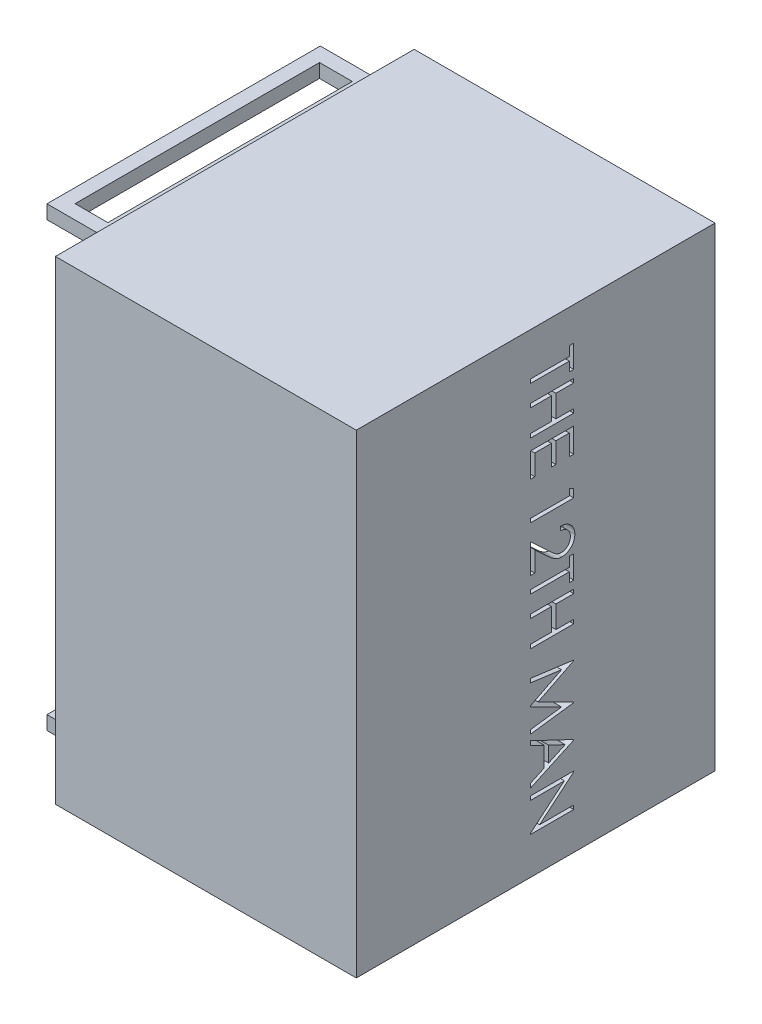
from build123d import *

# Parameters (mm, degrees)
SKETCH1_W           = 66.04
SKETCH1_H           = 104.14
BOSS_EXTRUDE1_DEPTH = 78.74
SHELL3_T            = -2.54
CUT_EXTRUDE7_DEPTH  = 40.64
CUT_EXTRUDE9_DEPTH  = 40.64
SKETCH8_W           = 59.988601374
SKETCH8_H           = 3.029727343
SKETCH8_H_2         = 3.029727342
BOSS_EXTRUDE3_DEPTH = 12.7
SKETCH9_W           = 7.202727341
SKETCH9_H           = 53.655099327
CUT_EXTRUDE10_DEPTH = 111.76


with BuildPart() as part:
    # Sketch1 → Boss-Extrude1 (new body)
    with BuildSketch(Plane.XY):
        with Locations((33.02, 52.07)):
            Rectangle(SKETCH1_W, SKETCH1_H)
    extrude(amount=BOSS_EXTRUDE1_DEPTH)

    # Shell3
    shell3_openings = [part.faces().sort_by_distance(p)[0] for p in [
        (33.02, 52.07, 0),
    ]]
    offset(amount=SHELL3_T, openings=shell3_openings, kind=Kind.INTERSECTION)

    # Sketch6 → Cut-Extrude7 (cut)
    # profile 1 of 10: a face of its own
    with BuildSketch(Plane(origin=(66.04, 0, 0), x_dir=(0, 0, -1), z_dir=(1, 0, 0))):
        Polygon((-31.996756627, 96.825288462), (-31.019833551, 96.825288462), (-31.019833551, 91.818557692), (-31.996756627, 91.818557692), (-31.996756627, 93.894519231), (-40.544833551, 93.894519231), (-40.544833551, 94.749326923), (-31.996756627, 94.749326923), align=None)
    # profile 2 of 10: a face of its own
    with BuildSketch(Plane(origin=(66.04, 0, 0), x_dir=(0, 0, -1), z_dir=(1, 0, 0))):
        Polygon((-31.019833551, 90.108942308), (-31.019833551, 89.254134615), (-34.927525858, 89.254134615), (-34.927525858, 84.369519231), (-31.019833551, 84.369519231), (-31.019833551, 83.514711538), (-40.544833551, 83.514711538), (-40.544833551, 84.369519231), (-35.904448935, 84.369519231), (-35.904448935, 89.254134615), (-40.544833551, 89.254134615), (-40.544833551, 90.108942308), align=None)
    # profile 3 of 10: a face of its own
    with BuildSketch(Plane(origin=(66.04, 0, 0), x_dir=(0, 0, -1), z_dir=(1, 0, 0))):
        Polygon((-31.019833551, 81.072403846), (-31.019833551, 75.699326923), (-31.996756627, 75.699326923), (-31.996756627, 80.217596154), (-34.927525858, 80.217596154), (-34.927525858, 75.699326923), (-35.904448935, 75.699326923), (-35.904448935, 80.217596154), (-39.567910474, 80.217596154), (-39.567910474, 75.699326923), (-40.544833551, 75.699326923), (-40.544833551, 81.072403846), align=None)
    # profile 4 of 10: a face of its own
    with BuildSketch(Plane(origin=(66.04, 0, 0), x_dir=(0, 0, -1), z_dir=(1, 0, 0))):
        Polygon((-31.019833551, 69.156613582), (-31.019833551, 67.395480769), (-40.544833551, 67.395480769), (-40.544833551, 68.250288462), (-31.996756627, 68.250288462), (-31.996756627, 69.715673077), align=None)
    # profile 5 of 10: a face of its own
    with BuildSketch(Plane(origin=(66.04, 0, 0), x_dir=(0, 0, -1), z_dir=(1, 0, 0))):
        with BuildLine():
            Line((-33.950602781, 62.632980769), (-33.950602781, 63.487788462))
            add(Edge.make_bspline(
                [(-33.950602781, 63.487788462), (-33.837197878, 63.482218229), (-33.614473665, 63.471278441), (-33.289750087, 63.420025178), (-32.979329471, 63.346756069), (-32.685873104, 63.242916648), (-32.405875402, 63.114684037), (-32.143054413, 62.957690211), (-31.894801667, 62.775282026), (-31.665817414, 62.567794117), (-31.456497177, 62.342650612), (-31.273825599, 62.101200471), (-31.121251832, 61.845925346), (-30.993010062, 61.579039383), (-30.896865922, 61.297455969), (-30.825497214, 61.003866724), (-30.782565304, 60.696944656), (-30.777950029, 60.48783026), (-30.775602781, 60.381478365)],
                knots=[0, 0, 0, 0, 1.100776268, 2.161895295, 3.184016182, 4.190939212, 5.176500551, 6.166955529, 7.155448256, 8.160289653, 9.16017456, 10.133824356, 11.091467644, 12.04088621, 13.000931625, 13.972173743, 14.968683325, 16, 16, 16, 16], degree=3))
            add(Edge.make_bspline(
                [(-30.775602781, 60.381478365), (-30.778047866, 60.277035178), (-30.782852371, 60.071808046), (-30.824112029, 59.772282135), (-30.888733961, 59.487138212), (-30.979399487, 59.216933648), (-31.101277107, 58.963824286), (-31.247683266, 58.725908715), (-31.417010093, 58.500354508), (-31.616365113, 58.297317476), (-31.829187317, 58.110877632), (-32.056393683, 57.950035066), (-32.291060525, 57.812294957), (-32.534977274, 57.697484199), (-32.790440572, 57.612967136), (-33.053731174, 57.548800727), (-33.32757441, 57.512531122), (-33.512921536, 57.506964648), (-33.607153262, 57.504134615)],
                knots=[0, 0, 0, 0, 1.111607364, 2.184268762, 3.212621178, 4.221274766, 5.211760367, 6.196651075, 7.1921475, 8.207485113, 9.220403448, 10.201281604, 11.166441695, 12.114753415, 13.065576456, 14.026450734, 14.996634279, 16, 16, 16, 16], degree=3))
            add(Edge.make_bspline(
                [(-33.607153262, 57.504134615), (-33.739817012, 57.508742709), (-34.002816451, 57.517878032), (-34.389299756, 57.596022156), (-34.763750418, 57.718068733), (-35.065114075, 57.865018683), (-35.307956655, 58.013261548), (-35.507896487, 58.146849694), (-35.723176369, 58.303236073), (-35.953075409, 58.484696842), (-36.199394372, 58.687478301), (-36.461984458, 58.913417189), (-36.738132632, 59.164124665), (-36.926742875, 59.340088156), (-37.024475978, 59.431268029)],
                knots=[0, 0, 0, 0, 1.184426356, 2.348067706, 3.509069118, 4.696110526, 5.333549288, 6.050745305, 6.844228056, 7.710549037, 8.667450064, 9.695053472, 10.805634456, 12, 12, 12, 12], degree=3))
            Line((-37.024475978, 59.431268029), (-39.567910474, 61.814426082))
            Line((-39.567910474, 61.814426082), (-39.567910474, 57.382019231))
            Line((-39.567910474, 57.382019231), (-40.544833551, 57.382019231))
            Line((-40.544833551, 57.382019231), (-40.544833551, 63.854134615))
            Line((-40.544833551, 63.854134615), (-36.602796291, 60.160144231))
            add(Edge.make_bspline(
                [(-36.602796291, 60.160144231), (-36.508916734, 60.0702004), (-36.32859332, 59.897436708), (-36.065246894, 59.653183612), (-35.821223644, 59.433452178), (-35.595442245, 59.238096647), (-35.389182666, 59.06695628), (-35.2008285, 58.920578652), (-35.031996146, 58.798316799), (-34.833658957, 58.668744712), (-34.591213606, 58.545189129), (-34.296423036, 58.436596414), (-33.992288171, 58.370855862), (-33.786825076, 58.362929391), (-33.683475377, 58.358942308)],
                knots=[0, 0, 0, 0, 1.329530082, 2.553755191, 3.672934919, 4.687409497, 5.60679272, 6.413407421, 7.126401618, 7.737995624, 8.834647426, 9.90044882, 10.943907757, 12, 12, 12, 12], degree=3))
            add(Edge.make_bspline(
                [(-33.683475377, 58.358942308), (-33.618476676, 58.360654663), (-33.490376716, 58.364029387), (-33.302685519, 58.394377114), (-33.120933467, 58.43896395), (-32.947367796, 58.507686036), (-32.778574803, 58.590253093), (-32.619686323, 58.695738596), (-32.465286227, 58.816280826), (-32.320668768, 58.9561039), (-32.188176719, 59.109603655), (-32.070820115, 59.271790415), (-31.972741593, 59.443375396), (-31.892341252, 59.623643525), (-31.829271059, 59.812090024), (-31.785568795, 60.009079965), (-31.758130032, 60.214068887), (-31.754417536, 60.354041473), (-31.752525858, 60.425363582)],
                knots=[0, 0, 0, 0, 0.991504627, 1.954065223, 2.895985987, 3.842598665, 4.797835564, 5.759220273, 6.74786863, 7.784730864, 8.824135544, 9.839918996, 10.835834653, 11.835434876, 12.84861661, 13.863796685, 14.911511676, 16, 16, 16, 16], degree=3))
            add(Edge.make_bspline(
                [(-31.752525858, 60.425363582), (-31.754471179, 60.499851679), (-31.758291468, 60.646134002), (-31.785031495, 60.860901823), (-31.831117999, 61.065803761), (-31.894301618, 61.261254599), (-31.973850295, 61.44744265), (-32.074843331, 61.622684403), (-32.193337583, 61.788579757), (-32.328414563, 61.944824021), (-32.479514174, 62.088387986), (-32.64587719, 62.217176527), (-32.828585783, 62.327019538), (-33.023513116, 62.424390424), (-33.235842064, 62.498893563), (-33.460427409, 62.562578129), (-33.700459972, 62.608840257), (-33.865836972, 62.624800282), (-33.950602781, 62.632980769)],
                knots=[0, 0, 0, 0, 1.031212865, 2.025131798, 2.990757446, 3.934781266, 4.865570067, 5.788494791, 6.729227313, 7.684356718, 8.643577152, 9.610526866, 10.590658432, 11.59095419, 12.621640561, 13.700587263, 14.82141059, 16, 16, 16, 16], degree=3))
        make_face()
    # profile 6 of 10: a face of its own
    with BuildSketch(Plane(origin=(66.04, 0, 0), x_dir=(0, 0, -1), z_dir=(1, 0, 0))):
        Polygon((-31.996756627, 56.771442308), (-31.019833551, 56.771442308), (-31.019833551, 51.764711538), (-31.996756627, 51.764711538), (-31.996756627, 53.840673077), (-40.544833551, 53.840673077), (-40.544833551, 54.695480769), (-31.996756627, 54.695480769), align=None)
    # profile 7 of 10: a face of its own
    with BuildSketch(Plane(origin=(66.04, 0, 0), x_dir=(0, 0, -1), z_dir=(1, 0, 0))):
        Polygon((-31.019833551, 50.055096154), (-31.019833551, 49.200288462), (-34.927525858, 49.200288462), (-34.927525858, 44.315673077), (-31.019833551, 44.315673077), (-31.019833551, 43.460865385), (-40.544833551, 43.460865385), (-40.544833551, 44.315673077), (-35.904448935, 44.315673077), (-35.904448935, 49.200288462), (-40.544833551, 49.200288462), (-40.544833551, 50.055096154), align=None)
    # profile 8 of 10: a face of its own
    with BuildSketch(Plane(origin=(66.04, 0, 0), x_dir=(0, 0, -1), z_dir=(1, 0, 0))):
        Polygon((-40.544833551, 37.843557692), (-31.019833551, 36.586150841), (-31.019833551, 36.464035457), (-38.835218166, 32.531538462), (-31.019833551, 28.608581731), (-31.019833551, 28.484558293), (-40.544833551, 27.219519231), (-40.544833551, 28.078143029), (-33.691107589, 28.990192308), (-40.544833551, 32.428503606), (-40.544833551, 32.621216947), (-33.675843166, 36.072884615), (-40.544833551, 36.983025841), align=None)
    # profile 9 of 10: a face of its own
    with BuildSketch(Plane(origin=(66.04, 0, 0), x_dir=(0, 0, -1), z_dir=(1, 0, 0))):
        Polygon((-31.019833551, 21.357980769), (-40.544833551, 16.961826923), (-40.544833551, 17.891048678), (-37.491948935, 19.299191707), (-37.491948935, 23.617115385), (-40.544833551, 25.065327524), (-40.544833551, 25.998365385), (-31.019833551, 21.480096154), align=None)
        Polygon((-32.876369007, 21.428578726), (-36.515025858, 23.153458534), (-36.515025858, 19.749492188), align=None, mode=Mode.SUBTRACT)
    # profile 10 of 10: a face of its own
    with BuildSketch(Plane(origin=(66.04, 0, 0), x_dir=(0, 0, -1), z_dir=(1, 0, 0))):
        Polygon((-40.544833551, 15.496442308), (-31.019833551, 15.496442308), (-31.019833551, 15.317085337), (-38.516573334, 9.024326923), (-31.019833551, 9.024326923), (-31.019833551, 8.169519231), (-40.544833551, 8.169519231), (-40.544833551, 8.364140625), (-33.065266243, 14.641634615), (-40.544833551, 14.641634615), align=None)
    extrude(amount=-CUT_EXTRUDE7_DEPTH, mode=Mode.SUBTRACT)


with BuildPart() as cut_extrude7_piece_1:
    # of the separate pieces the step leaves, piece 1, a body of its own (cut_extrude7_pieces)
    add(part.part.solids().sort_by_distance((0, 0, 0))[0])

    # Sketch7 → Cut-Extrude9 (cut)
    # profile 1 of 10: a face of its own
    with BuildSketch(Plane.ZY):
        Polygon((39.37, 88.399326923), (29.845, 88.399326923), (29.845, 88.578683894), (37.341739784, 94.871442308), (29.845, 94.871442308), (29.845, 95.72625), (39.37, 95.72625), (39.37, 95.531628606), (31.890432692, 89.254134615), (39.37, 89.254134615), align=None)
    # profile 2 of 10: a face of its own
    with BuildSketch(Plane.ZY):
        Polygon((29.845, 82.537788462), (39.37, 86.933942308), (39.37, 86.004720553), (36.317115385, 84.596577524), (36.317115385, 80.278653846), (39.37, 78.830441707), (39.37, 77.897403846), (29.845, 82.415673077), align=None)
        Polygon((31.701535457, 82.467190505), (35.340192308, 80.742310697), (35.340192308, 84.146277043), align=None, mode=Mode.SUBTRACT)
    # profile 3 of 10: a face of its own
    with BuildSketch(Plane.ZY):
        Polygon((39.37, 66.052211538), (29.845, 67.309618389), (29.845, 67.431733774), (37.660384615, 71.364230769), (29.845, 75.2871875), (29.845, 75.411210937), (39.37, 76.67625), (39.37, 75.817626202), (32.516274038, 74.905576923), (39.37, 71.467265625), (39.37, 71.274552284), (32.501009615, 67.822884615), (39.37, 66.912743389), align=None)
    # profile 4 of 10: a face of its own
    with BuildSketch(Plane.ZY):
        Polygon((29.845, 53.840673077), (29.845, 54.695480769), (33.752692308, 54.695480769), (33.752692308, 59.580096154), (29.845, 59.580096154), (29.845, 60.434903846), (39.37, 60.434903846), (39.37, 59.580096154), (34.729615385, 59.580096154), (34.729615385, 54.695480769), (39.37, 54.695480769), (39.37, 53.840673077), align=None)
    # profile 5 of 10: a face of its own
    with BuildSketch(Plane.ZY):
        Polygon((30.821923077, 47.124326923), (29.845, 47.124326923), (29.845, 52.131057692), (30.821923077, 52.131057692), (30.821923077, 50.055096154), (39.37, 50.055096154), (39.37, 49.200288462), (30.821923077, 49.200288462), align=None)
    # profile 6 of 10: a face of its own
    with BuildSketch(Plane.ZY):
        with BuildLine():
            Line((32.775769231, 41.262788462), (32.775769231, 40.407980769))
            add(Edge.make_bspline(
                [(32.775769231, 40.407980769), (32.662364886, 40.41355195), (32.439641772, 40.424493601), (32.114910283, 40.475733445), (31.804518295, 40.549051118), (31.51095803, 40.652714289), (31.231633847, 40.781454945), (30.967655233, 40.935841662), (30.720029212, 41.118704927), (30.49105136, 41.32609611), (30.2809909, 41.55134505), (30.099593417, 41.794384785), (29.946328897, 42.049777323), (29.818200661, 42.316747831), (29.722025794, 42.598308364), (29.650665475, 42.891903856), (29.607731277, 43.19882422), (29.603116318, 43.407938851), (29.600769231, 43.514290865)],
                knots=[0, 0, 0, 0, 1.10065271, 2.161652631, 3.183658789, 4.190468796, 5.17591951, 6.163126047, 7.15150782, 8.156236427, 9.156009102, 10.134482811, 11.092018607, 12.041330605, 13.001268258, 13.972401359, 14.968799086, 16, 16, 16, 16], degree=3))
            add(Edge.make_bspline(
                [(29.600769231, 43.514290865), (29.603194474, 43.618741403), (29.60795999, 43.823982978), (29.649500344, 44.12340491), (29.713157235, 44.409125244), (29.80748672, 44.677905914), (29.925849589, 44.932505364), (30.073049324, 45.169771232), (30.242120929, 45.395440852), (30.441549178, 45.598438753), (30.654339623, 45.784916815), (30.881598029, 45.945649629), (31.116590219, 46.084073994), (31.361151823, 46.197370013), (31.616079253, 46.283253433), (31.878928432, 46.346884817), (32.152732817, 46.383259954), (32.338085275, 46.388811946), (32.432319712, 46.391634615)],
                knots=[0, 0, 0, 0, 1.111674182, 2.184400057, 3.212814286, 4.223731311, 5.211378316, 6.196328225, 7.191884489, 8.207283132, 9.220262353, 10.201199469, 11.166417575, 12.120932471, 13.06540007, 14.026332106, 14.996573967, 16, 16, 16, 16], degree=3))
            add(Edge.make_bspline(
                [(32.432319712, 46.391634615), (32.564983404, 46.387026449), (32.82798273, 46.377890983), (33.214466872, 46.29974792), (33.588914347, 46.177697303), (33.890288277, 46.030760376), (34.133107866, 45.882488363), (34.333132229, 45.74900739), (34.548448015, 45.59185716), (34.779926712, 45.412380296), (35.024536912, 45.207485951), (35.287269319, 44.982497253), (35.563265831, 44.731603791), (35.751897976, 44.555667158), (35.849642428, 44.464501202)],
                knots=[0, 0, 0, 0, 1.184416499, 2.348048165, 3.509039915, 4.696071444, 5.333504901, 6.05069495, 6.844171097, 7.714965912, 8.667477798, 9.695072654, 10.805644396, 12, 12, 12, 12], degree=3))
            Line((35.849642428, 44.464501202), (38.393076923, 42.081343149))
            Line((38.393076923, 42.081343149), (38.393076923, 46.51375))
            Line((38.393076923, 46.51375), (39.37, 46.51375))
            Line((39.37, 46.51375), (39.37, 40.041634615))
            Line((39.37, 40.041634615), (35.42796274, 43.735625))
            add(Edge.make_bspline(
                [(35.42796274, 43.735625), (35.334078063, 43.825562463), (35.153744813, 43.998313924), (34.890465757, 44.242650794), (34.646218792, 44.462104041), (34.4214654, 44.658094231), (34.212918062, 44.826369699), (34.027331047, 44.975700559), (33.856549293, 45.095349775), (33.658590908, 45.225203816), (33.41689453, 45.350971865), (33.121527848, 45.459046205), (32.81747011, 45.524945186), (32.611996709, 45.532850488), (32.508641827, 45.536826923)],
                knots=[0, 0, 0, 0, 1.329631726, 2.553950428, 3.673215718, 4.687767853, 5.603093632, 6.413772471, 7.123043292, 7.734684054, 8.834405432, 9.900288307, 10.943827018, 12, 12, 12, 12], degree=3))
            add(Edge.make_bspline(
                [(32.508641827, 45.536826923), (32.443650307, 45.535096796), (32.315564501, 45.531687047), (32.127770257, 45.501594313), (31.946618871, 45.456117865), (31.771553129, 45.390952555), (31.604333176, 45.30493707), (31.444755462, 45.200234514), (31.290480492, 45.079430127), (31.145827588, 44.939681316), (31.013345165, 44.786161394), (30.895986047, 44.623979901), (30.797908181, 44.452393545), (30.717507663, 44.272125784), (30.654437519, 44.083679186), (30.610735242, 43.886689272), (30.583296482, 43.681700342), (30.579583986, 43.541727757), (30.577692308, 43.470405649)],
                knots=[0, 0, 0, 0, 0.991446411, 1.95395049, 2.89581595, 3.838931463, 4.798493298, 5.75982156, 6.748411868, 7.785213223, 8.824556874, 9.840280684, 10.836137867, 11.835679398, 12.848801643, 13.863922112, 14.911575587, 16, 16, 16, 16], degree=3))
            add(Edge.make_bspline(
                [(30.577692308, 43.470405649), (30.579561434, 43.395899187), (30.583232091, 43.249580797), (30.611035472, 43.035208996), (30.653185411, 42.829295532), (30.720128714, 42.634912816), (30.799225553, 42.447851615), (30.899709563, 42.27210539), (31.016474215, 42.104756214), (31.151867591, 41.948556658), (31.303991836, 41.80589675), (31.471643256, 41.678788834), (31.653614894, 41.568459178), (31.849159903, 41.472063135), (32.060225182, 41.393815659), (32.286013537, 41.334014724), (32.525558092, 41.286698384), (32.690980267, 41.270890809), (32.775769231, 41.262788462)],
                knots=[0, 0, 0, 0, 1.030878251, 2.024474673, 2.987898669, 3.934362936, 4.864849709, 5.795128259, 6.730474222, 7.685293701, 8.650606017, 9.611896181, 10.591709709, 11.591680886, 12.625074257, 13.701333388, 14.821793024, 16, 16, 16, 16], degree=3))
        make_face()
    # profile 7 of 10: a face of its own
    with BuildSketch(Plane.ZY):
        Polygon((29.845, 34.739155649), (29.845, 36.500288462), (39.37, 36.500288462), (39.37, 35.645480769), (30.821923077, 35.645480769), (30.821923077, 34.180096154), align=None)
    # profile 8 of 10: a face of its own
    with BuildSketch(Plane.ZY):
        Polygon((29.845, 22.823365385), (29.845, 28.196442308), (30.821923077, 28.196442308), (30.821923077, 23.678173077), (33.752692308, 23.678173077), (33.752692308, 28.196442308), (34.729615385, 28.196442308), (34.729615385, 23.678173077), (38.393076923, 23.678173077), (38.393076923, 28.196442308), (39.37, 28.196442308), (39.37, 22.823365385), align=None)
    # profile 9 of 10: a face of its own
    with BuildSketch(Plane.ZY):
        Polygon((29.845, 13.786826923), (29.845, 14.641634615), (33.752692308, 14.641634615), (33.752692308, 19.52625), (29.845, 19.52625), (29.845, 20.381057692), (39.37, 20.381057692), (39.37, 19.52625), (34.729615385, 19.52625), (34.729615385, 14.641634615), (39.37, 14.641634615), (39.37, 13.786826923), align=None)
    # profile 10 of 10: a face of its own
    with BuildSketch(Plane.ZY):
        Polygon((30.821923077, 7.070480769), (29.845, 7.070480769), (29.845, 12.077211538), (30.821923077, 12.077211538), (30.821923077, 10.00125), (39.37, 10.00125), (39.37, 9.146442308), (30.821923077, 9.146442308), align=None)
    extrude(amount=-CUT_EXTRUDE9_DEPTH, mode=Mode.SUBTRACT)


with BuildPart() as cut_extrude7_piece_2:
    # of the separate pieces the step leaves, piece 2, a body of its own (cut_extrude7_pieces)
    add(part.part.solids().sort_by_distance((66.04, 21.428578726, 32.876369007))[0])


with BuildPart() as cut_extrude9_piece_1:
    # of the separate pieces the step leaves, piece 1, a body of its own (cut_extrude9_pieces)
    add(cut_extrude7_piece_1.part.solids().sort_by_distance((0, 0, 0))[0])

    # Sketch8 → Boss-Extrude3 (add)
    with BuildSketch(Plane.ZY):
        with Locations((37.900765851, 3.757109113)):
            Rectangle(SKETCH8_W, SKETCH8_H)
        with Locations((37.900765851, 100.859870427)):
            Rectangle(SKETCH8_W, SKETCH8_H_2)
    extrude(amount=BOSS_EXTRUDE3_DEPTH)

    # Sketch9 → Cut-Extrude10 (cut)
    with BuildSketch(Plane(origin=(0, 102.374734098, 0), x_dir=(1, 0, 0), z_dir=(0, 1, 0))):
        with Locations((-6.038332885, -37.960770738)):
            Rectangle(SKETCH9_W, SKETCH9_H)
    extrude(amount=-CUT_EXTRUDE10_DEPTH, mode=Mode.SUBTRACT)


with BuildPart() as cut_extrude9_piece_2:
    # of the separate pieces the step leaves, piece 2, a body of its own (cut_extrude9_pieces)
    add(cut_extrude7_piece_1.part.solids().sort_by_distance((0, 82.467190505, 31.701535457))[0])


solid = Compound([cut_extrude7_piece_2.part, cut_extrude9_piece_1.part, cut_extrude9_piece_2.part])
